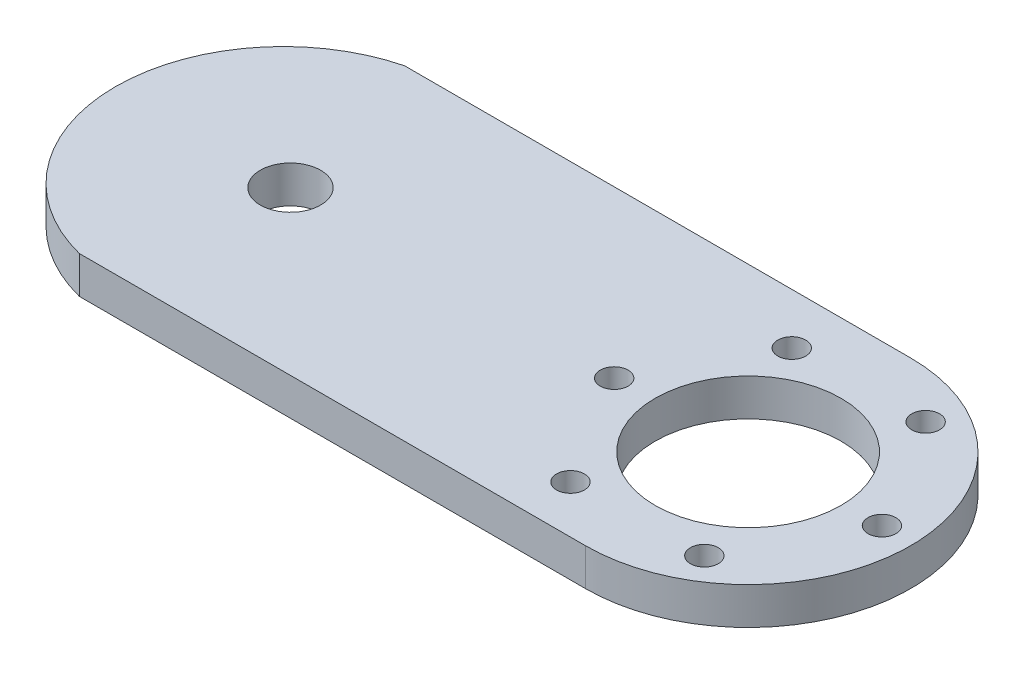
from build123d import *

# Parameters (mm, degrees)
SKETCH_1_R          = 6.5
SKETCH_1_R_2        = 20
EXTRUDE_1_DEPTH     = 8
SKETCH_2_R          = 3
CUT_EXTRUDE_1_DEPTH = 10


with BuildPart() as part:
    # Эскиз1 → Вытянуть1 (new body)
    with BuildSketch(Plane(origin=(0, 0, 0), x_dir=(1, 0, 0), z_dir=(0, 1, 0))):
        with BuildLine():
            Line((1.738556374, 18.516613497), (110.672099026, 18.516613497))
            ThreePointArc((110.672099026, 18.516613497), (145.672099026, -16.483386503), (110.672099026, -51.483386503))
            Line((110.672099026, -51.483386503), (1.738556374, -51.483386503))
            ThreePointArc((1.738556374, -51.483386503), (-25.499232193, -16.483386503), (1.738556374, 18.516613497))
        make_face()
        with Locations(Location((12.165325646, -16.483386503, 0), (0, 0, 270))):
            Circle(SKETCH_1_R, mode=Mode.SUBTRACT)
        with Locations(Location((110.670387559, -16.483386503, 0), (0, 0, 270))):
            Circle(SKETCH_1_R_2, mode=Mode.SUBTRACT)
    extrude(amount=EXTRUDE_1_DEPTH)

    # Эскиз2 → Вырез-Вытянуть1 (cut)
    with BuildSketch(Plane(origin=(0, 8, 0), x_dir=(1, 0, 0), z_dir=(0, 1, 0))):
        with Locations(Location((96.021590781, 7.563843825, 0), (0, 0, 270))):
            Circle(SKETCH_2_R)
        with Locations(Location((124.179862127, 8.221889416, 0), (0, 0, 270))):
            Circle(SKETCH_2_R)
        with Locations(Location((138.828881998, -15.834866101, 0), (0, 0, 270))):
            Circle(SKETCH_2_R)
        with Locations(Location((125.319630524, -40.549667208, 0), (0, 0, 270))):
            Circle(SKETCH_2_R)
        with Locations(Location((97.161359178, -41.207712799, 0), (0, 0, 270))):
            Circle(SKETCH_2_R)
        with Locations(Location((82.512339307, -17.150957282, 0), (0, 0, 270))):
            Circle(SKETCH_2_R)
    extrude(amount=-CUT_EXTRUDE_1_DEPTH, mode=Mode.SUBTRACT)


solid = part.part
